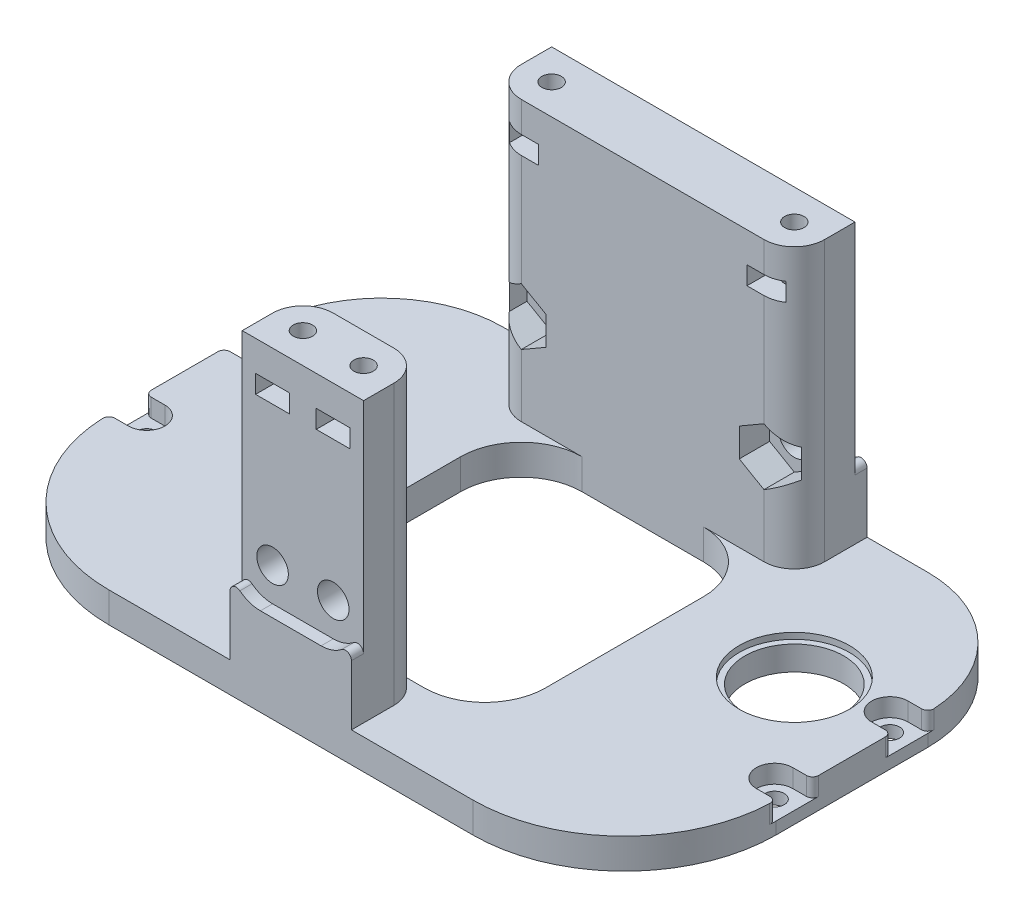
from build123d import *

# Parameters (mm, degrees)
CROQUIS1_R              = 8.15
CROQUIS1_R_2            = 1.6
SALIENTE_EXTRUIR1_DEPTH = 5
CROQUIS2_R              = 9.1
CORTAR_EXTRUIR1_DEPTH   = 1
CORTAR_EXTRUIR2_DEPTH   = 3
REDONDEO1_R             = 1
SALIENTE_EXTRUIR2_DEPTH = 46
CORTAR_EXTRUIR3_DEPTH   = 2
CORTAR_EXTRUIR4_REACH   = 103.242
CROQUIS6_R              = 2.6
CROQUIS6_W              = 5.6
CROQUIS6_H              = 3
CORTAR_EXTRUIR5_DEPTH   = 5
SALIENTE_EXTRUIR3_DEPTH = 46
CORTAR_EXTRUIR6_DEPTH   = 2
CORTAR_EXTRUIR7_REACH   = 103.242
CROQUIS10_R             = 2.6
CROQUIS10_W             = 5.6
CROQUIS10_H             = 3
CROQUIS11_R             = 1.6
CORTAR_EXTRUIR8_DEPTH   = 21
REDONDEO2_R             = 1


with BuildPart() as part:
    # Croquis1 → Saliente-Extruir1 (new body)
    with BuildSketch(Plane(origin=(0, 0, 0), x_dir=(1, 0, 0), z_dir=(0, 1, 0))):
        with BuildLine():
            Line((-30, -35), (30, -35))
            ThreePointArc((30, -35), (47.67766953, -27.67766953), (55, -10))
            Line((55, -10), (55, 15))
            ThreePointArc((55, 15), (49.142135624, 29.142135624), (35, 35))
            Line((35, 35), (-35, 35))
            ThreePointArc((-35, 35), (-49.142135624, 29.142135624), (-55, 15))
            Line((-55, 15), (-55, -10))
            ThreePointArc((-55, -10), (-47.67766953, -27.67766953), (-30, -35))
        make_face()
        with Locations(Location((39, 9, 0), (0, 0, 270))):
            Circle(CROQUIS1_R, mode=Mode.SUBTRACT)
        with Locations(Location((51.75, 12, 0), (0, 0, 270))):
            Circle(CROQUIS1_R_2, mode=Mode.SUBTRACT)
        with Locations(Location((-39, 9, 0), (0, 0, 90))):
            Circle(CROQUIS1_R, mode=Mode.SUBTRACT)
        with Locations(Location((51.75, -7, 0), (0, 0, 90))):
            Circle(CROQUIS1_R_2, mode=Mode.SUBTRACT)
        with Locations(Location((-51.75, -7, 0), (0, 0, 270))):
            Circle(CROQUIS1_R_2, mode=Mode.SUBTRACT)
        with Locations(Location((-51.75, 12, 0), (0, 0, 90))):
            Circle(CROQUIS1_R_2, mode=Mode.SUBTRACT)
        with BuildLine():
            Line((-10, -23), (10, -23))
            ThreePointArc((10, -23), (17.071067812, -20.071067812), (20, -13))
            Line((20, -13), (20, 13))
            ThreePointArc((20, 13), (17.071067812, 20.071067812), (10, 23))
            Line((10, 23), (-10, 23))
            ThreePointArc((-10, 23), (-17.071067812, 20.071067812), (-20, 13))
            Line((-20, 13), (-20, -13))
            ThreePointArc((-20, -13), (-17.071067812, -20.071067812), (-10, -23))
        make_face(mode=Mode.SUBTRACT)
    extrude(amount=SALIENTE_EXTRUIR1_DEPTH)

    # Croquis2 → Cortar-Extruir1 (cut)
    with BuildSketch(Plane(origin=(0, 5, 0), x_dir=(1, 0, 0), z_dir=(0, 1, 0))):
        with Locations(Location((39, 9, 0), (0, 0, 270))):
            Circle(CROQUIS2_R)
        with Locations(Location((-39, 9, 0), (0, 0, 90))):
            Circle(CROQUIS2_R)
    extrude(amount=-CORTAR_EXTRUIR1_DEPTH, mode=Mode.SUBTRACT)

    # Croquis3 → Cortar-Extruir2 (cut)
    with BuildSketch(Plane(origin=(0, 5, 0), x_dir=(1, 0, 0), z_dir=(0, 1, 0))):
        with BuildLine():
            Line((51.75, 15), (55, 15))
            Line((55, 15), (55, 9))
            Line((55, 9), (51.75, 9))
            ThreePointArc((51.75, 9), (48.75, 12), (51.75, 15))
        make_face()
        with BuildLine():
            Line((51.75, -10), (55, -10))
            Line((55, -10), (55, -4))
            Line((55, -4), (51.75, -4))
            ThreePointArc((51.75, -4), (48.75, -7), (51.75, -10))
        make_face()
        with BuildLine():
            Line((-51.75, -4), (-55, -4))
            Line((-55, -4), (-55, -10))
            Line((-55, -10), (-51.75, -10))
            ThreePointArc((-51.75, -10), (-48.75, -7), (-51.75, -4))
        make_face()
        with BuildLine():
            Line((-51.75, 15), (-55, 15))
            Line((-55, 15), (-55, 9))
            Line((-55, 9), (-51.75, 9))
            ThreePointArc((-51.75, 9), (-48.75, 12), (-51.75, 15))
        make_face()
    extrude(amount=-CORTAR_EXTRUIR2_DEPTH, mode=Mode.SUBTRACT)

    # Redondeo1
    redondeo1_edges = [part.edges().sort_by_distance(p)[0] for p in [
        (-55, 3.5, -9),
        (-55, 3.5, 4),
        (55, 3.5, 4),
        (55, 3.5, -9),
        (55, 3.5, -15),
        (55, 3.5, 10),
        (-55, 3.5, 10),
        (-55, 3.5, -15),
    ]]
    fillet(redondeo1_edges, radius=REDONDEO1_R)

    # Croquis4 → Saliente-Extruir2 (add)
    with BuildSketch(Plane(origin=(0, 5, 0), x_dir=(1, 0, 0), z_dir=(0, 1, 0))):
        with BuildLine():
            Line((-25, 35), (25, 35))
            Line((25, 35), (25, 28))
            ThreePointArc((25, 28), (23.535533906, 24.464466094), (20, 23))
            Line((20, 23), (-20, 23))
            ThreePointArc((-20, 23), (-23.535533906, 24.464466094), (-25, 28))
            Line((-25, 28), (-25, 35))
        make_face()
    extrude(amount=SALIENTE_EXTRUIR2_DEPTH)

    # Croquis5 → Cortar-Extruir3 (cut)
    with BuildSketch(Plane(origin=(0, 0, -35), x_dir=(-1, 0, 0), z_dir=(0, 0, -1))):
        with BuildLine():
            Line((-25, 51), (25, 51))
            Line((25, 51), (25, 17.708712153))
            ThreePointArc((25, 17.708712153), (22.970514841, 15.371172764), (20, 14.5))
            Line((20, 14.5), (-20, 14.5))
            ThreePointArc((-20, 14.5), (-22.970514841, 15.371172764), (-25, 17.708712153))
            Line((-25, 17.708712153), (-25, 51))
        make_face()
    extrude(amount=-CORTAR_EXTRUIR3_DEPTH, mode=Mode.SUBTRACT)

    # Cortar-Extruir4: up to this face of the body (flat: up to its plane)
    cortar_extruir4_end = Plane(part.part.faces().sort_by_distance((0, 26.68556701, -23))[0])
    # Croquis6 → Cortar-Extruir4 (cut, up to the picked face)
    with BuildSketch(Plane(origin=(0, 0, -33), x_dir=(-1, 0, 0), z_dir=(0, 0, -1)), mode=Mode.PRIVATE) as cortar_extruir4_sk1:
        with Locations((-20, 20)):
            Circle(CROQUIS6_R)
    cortar_extruir4_tool1 = split(extrude(cortar_extruir4_sk1.sketch, amount=-CORTAR_EXTRUIR4_REACH, mode=Mode.PRIVATE), bisect_by=cortar_extruir4_end, keep=Keep.BOTH, mode=Mode.PRIVATE)
    # Croquis6 → Cortar-Extruir4 (cut, up to the picked face)
    with BuildSketch(Plane(origin=(0, 0, -33), x_dir=(-1, 0, 0), z_dir=(0, 0, -1)), mode=Mode.PRIVATE) as cortar_extruir4_sk2:
        with Locations(Location((20, 20, 0), (0, 0, 90))):
            Circle(CROQUIS6_R)
    cortar_extruir4_tool2 = split(extrude(cortar_extruir4_sk2.sketch, amount=-CORTAR_EXTRUIR4_REACH, mode=Mode.PRIVATE), bisect_by=cortar_extruir4_end, keep=Keep.BOTH, mode=Mode.PRIVATE)
    # Croquis6 → Cortar-Extruir4 (cut, up to the picked face)
    with BuildSketch(Plane(origin=(0, 0, -33), x_dir=(-1, 0, 0), z_dir=(0, 0, -1)), mode=Mode.PRIVATE) as cortar_extruir4_sk3:
        with Locations((-20, 44.5)):
            Rectangle(CROQUIS6_W, CROQUIS6_H)
    cortar_extruir4_tool3 = split(extrude(cortar_extruir4_sk3.sketch, amount=-CORTAR_EXTRUIR4_REACH, mode=Mode.PRIVATE), bisect_by=cortar_extruir4_end, keep=Keep.BOTH, mode=Mode.PRIVATE)
    # Croquis6 → Cortar-Extruir4 (cut, up to the picked face)
    with BuildSketch(Plane(origin=(0, 0, -33), x_dir=(-1, 0, 0), z_dir=(0, 0, -1)), mode=Mode.PRIVATE) as cortar_extruir4_sk4:
        with Locations((20, 44.5)):
            Rectangle(CROQUIS6_W, CROQUIS6_H)
    cortar_extruir4_tool4 = split(extrude(cortar_extruir4_sk4.sketch, amount=-CORTAR_EXTRUIR4_REACH, mode=Mode.PRIVATE), bisect_by=cortar_extruir4_end, keep=Keep.BOTH, mode=Mode.PRIVATE)
    add(cortar_extruir4_tool1.solids().sort_by(Axis((20, 20, -33), (0, 0, 1)))[0], mode=Mode.SUBTRACT)
    add(cortar_extruir4_tool2.solids().sort_by(Axis((-20, 20, -33), (0, 0, 1)))[0], mode=Mode.SUBTRACT)
    add(cortar_extruir4_tool3.solids().sort_by(Axis((20, 44.5, -33), (0, 0, 1)))[0], mode=Mode.SUBTRACT)
    add(cortar_extruir4_tool4.solids().sort_by(Axis((-20, 44.5, -33), (0, 0, 1)))[0], mode=Mode.SUBTRACT)

    # Croquis7 → Cortar-Extruir5 (cut)
    with BuildSketch(Plane.XY.offset(-23)):
        Polygon((-20, 24.7), (-24.070319398, 22.35), (-24.070319398, 17.65), (-20, 15.3), (-15.929680602, 17.65), (-15.929680602, 22.35), align=None)
        Polygon((15.929680602, 22.35), (20, 24.7), (24.070319398, 22.35), (24.070319398, 17.65), (20, 15.3), (15.929680602, 17.65), align=None)
    extrude(amount=-CORTAR_EXTRUIR5_DEPTH, mode=Mode.SUBTRACT)

    # Croquis8 → Saliente-Extruir3 (add)
    with BuildSketch(Plane(origin=(0, 5, 0), x_dir=(1, 0, 0), z_dir=(0, 1, 0))):
        with BuildLine():
            Line((-10, -35), (10, -35))
            Line((10, -35), (10, -28))
            ThreePointArc((10, -28), (8.535533906, -24.464466094), (5, -23))
            Line((5, -23), (-5, -23))
            ThreePointArc((-5, -23), (-8.535533906, -24.464466094), (-10, -28))
            Line((-10, -28), (-10, -35))
        make_face()
    extrude(amount=SALIENTE_EXTRUIR3_DEPTH)

    # Croquis9 → Cortar-Extruir6 (cut)
    with BuildSketch(Plane.XY.offset(35)):
        with BuildLine():
            Line((10, 17.708712153), (10, 51))
            Line((10, 51), (-10, 51))
            Line((-10, 51), (-10, 17.708712153))
            ThreePointArc((-10, 17.708712153), (-7.970514841, 15.371172764), (-5, 14.5))
            Line((-5, 14.5), (5, 14.5))
            ThreePointArc((5, 14.5), (7.970514841, 15.371172764), (10, 17.708712153))
        make_face()
    extrude(amount=-CORTAR_EXTRUIR6_DEPTH, mode=Mode.SUBTRACT)

    # Cortar-Extruir7: up to this face of the body (flat: up to its plane)
    cortar_extruir7_end = Plane(part.part.faces().sort_by_distance((0, 23.446428571, 23))[0])
    # Croquis10 → Cortar-Extruir7 (cut, up to the picked face)
    with BuildSketch(Plane.XY.offset(33), mode=Mode.PRIVATE) as cortar_extruir7_sk1:
        with Locations((-5, 20)):
            Circle(CROQUIS10_R)
    cortar_extruir7_tool1 = split(extrude(cortar_extruir7_sk1.sketch, amount=-CORTAR_EXTRUIR7_REACH, mode=Mode.PRIVATE), bisect_by=cortar_extruir7_end, keep=Keep.BOTH, mode=Mode.PRIVATE)
    # Croquis10 → Cortar-Extruir7 (cut, up to the picked face)
    with BuildSketch(Plane.XY.offset(33), mode=Mode.PRIVATE) as cortar_extruir7_sk2:
        with Locations(Location((5, 20, 0), (0, 0, 90))):
            Circle(CROQUIS10_R)
    cortar_extruir7_tool2 = split(extrude(cortar_extruir7_sk2.sketch, amount=-CORTAR_EXTRUIR7_REACH, mode=Mode.PRIVATE), bisect_by=cortar_extruir7_end, keep=Keep.BOTH, mode=Mode.PRIVATE)
    # Croquis10 → Cortar-Extruir7 (cut, up to the picked face)
    with BuildSketch(Plane.XY.offset(33), mode=Mode.PRIVATE) as cortar_extruir7_sk3:
        with Locations((-5, 44.5)):
            Rectangle(CROQUIS10_W, CROQUIS10_H)
    cortar_extruir7_tool3 = split(extrude(cortar_extruir7_sk3.sketch, amount=-CORTAR_EXTRUIR7_REACH, mode=Mode.PRIVATE), bisect_by=cortar_extruir7_end, keep=Keep.BOTH, mode=Mode.PRIVATE)
    # Croquis10 → Cortar-Extruir7 (cut, up to the picked face)
    with BuildSketch(Plane.XY.offset(33), mode=Mode.PRIVATE) as cortar_extruir7_sk4:
        with Locations((5, 44.5)):
            Rectangle(CROQUIS10_W, CROQUIS10_H)
    cortar_extruir7_tool4 = split(extrude(cortar_extruir7_sk4.sketch, amount=-CORTAR_EXTRUIR7_REACH, mode=Mode.PRIVATE), bisect_by=cortar_extruir7_end, keep=Keep.BOTH, mode=Mode.PRIVATE)
    add(cortar_extruir7_tool1.solids().sort_by(Axis((-5, 20, 33), (0, 0, -1)))[0], mode=Mode.SUBTRACT)
    add(cortar_extruir7_tool2.solids().sort_by(Axis((5, 20, 33), (0, 0, -1)))[0], mode=Mode.SUBTRACT)
    add(cortar_extruir7_tool3.solids().sort_by(Axis((-5, 44.5, 33), (0, 0, -1)))[0], mode=Mode.SUBTRACT)
    add(cortar_extruir7_tool4.solids().sort_by(Axis((5, 44.5, 33), (0, 0, -1)))[0], mode=Mode.SUBTRACT)

    # Croquis11 → Cortar-Extruir8 (cut)
    with BuildSketch(Plane(origin=(0, 51, 0), x_dir=(1, 0, 0), z_dir=(0, 1, 0))):
        with Locations(Location((-5, -28, 0), (0, 0, 270))):
            Circle(CROQUIS11_R)
        with Locations(Location((-20, 28, 0), (0, 0, 270))):
            Circle(CROQUIS11_R)
        with Locations(Location((5, -28, 0), (0, 0, 270))):
            Circle(CROQUIS11_R)
        with Locations(Location((20, 28, 0), (0, 0, 270))):
            Circle(CROQUIS11_R)
    extrude(amount=-CORTAR_EXTRUIR8_DEPTH, mode=Mode.SUBTRACT)

    # Redondeo2
    redondeo2_edges = [part.edges().sort_by_distance(p)[0] for p in [
        (25, 17.708712153, -34),
        (-25, 17.708712153, -34),
        (10, 17.708712153, 34),
        (-10, 17.708712153, 34),
    ]]
    fillet(redondeo2_edges, radius=REDONDEO2_R)


solid = part.part
